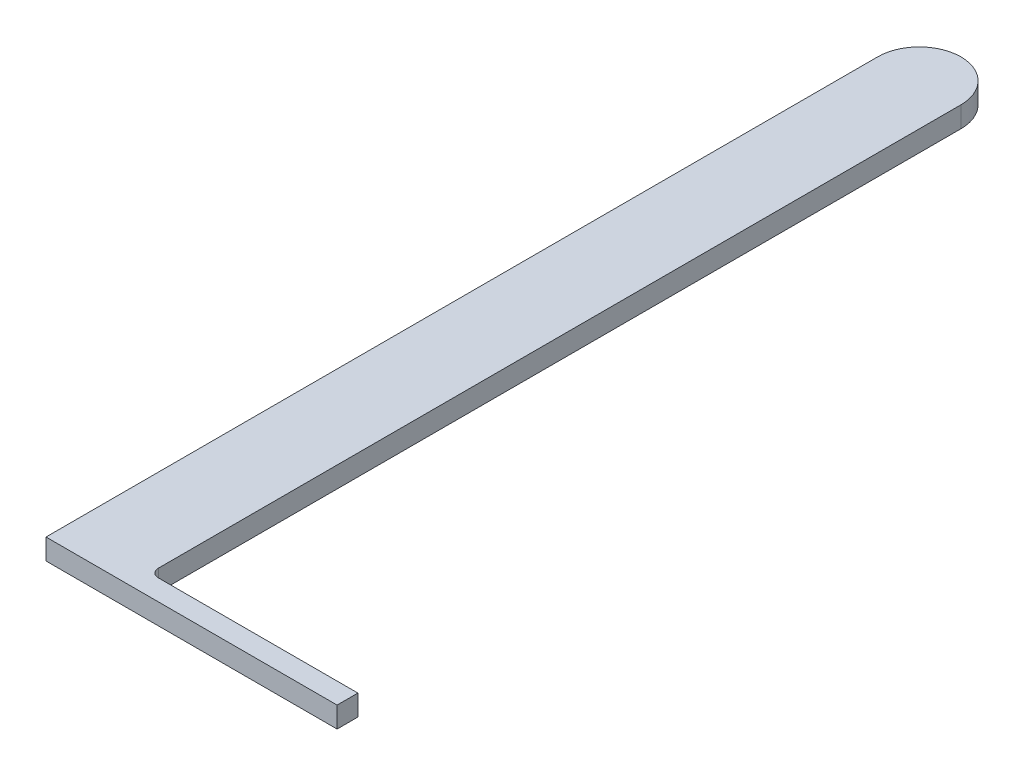
from build123d import *

# Parameters (mm, degrees)
BOSS_EXTRUDE1_DEPTH = 6.35
SKETCH2_W           = 88.9
SKETCH2_H           = 6.35
BOSS_EXTRUDE2_DEPTH = 6.35
FILLET1_R           = 2.54


with BuildPart() as part:
    # Sketch1 → Boss-Extrude1 (new body)
    with BuildSketch(Plane(origin=(0, 0, 0), x_dir=(1, 0, 0), z_dir=(0, 1, 0))):
        with BuildLine():
            ThreePointArc((12.7, 0), (0, -12.7), (-12.7, 0))
            Line((-12.7, 0), (-12.7, -247.65))
            Line((-12.7, -247.65), (12.7, -247.65))
            Line((12.7, -247.65), (12.7, 0))
        make_face()
        with BuildLine():
            ThreePointArc((12.7, 0), (0, 12.7), (-12.7, 0))
            Line((-12.7, 0), (12.7, 0))
        make_face()
        with BuildLine():
            Line((12.7, 0), (-12.7, 0))
            ThreePointArc((-12.7, 0), (0, -12.7), (12.7, 0))
        make_face()
    extrude(amount=BOSS_EXTRUDE1_DEPTH)

    # Sketch2 → Boss-Extrude2 (add)
    with BuildSketch(Plane(origin=(0, 6.35, 0), x_dir=(1, 0, 0), z_dir=(0, 1, 0))):
        with Locations((31.75, -250.825)):
            Rectangle(SKETCH2_W, SKETCH2_H)
    extrude(amount=-BOSS_EXTRUDE2_DEPTH)

    # Fillet1
    fillet1_edges = [part.edges().sort_by_distance(p)[0] for p in [
        (12.7, 3.175, 247.65),
    ]]
    fillet(fillet1_edges, radius=FILLET1_R)


solid = part.part
